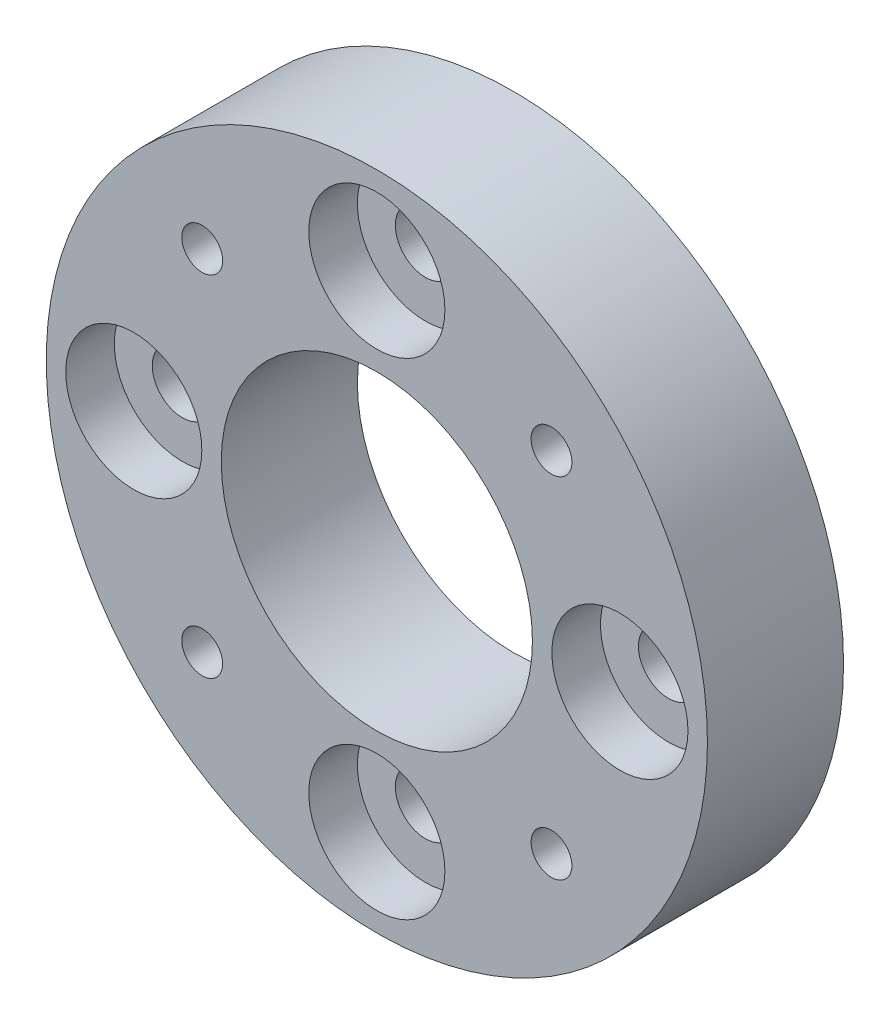
from build123d import *

# Parameters (mm, degrees)
SKETCH1_R           = 17
SKETCH1_R_2         = 1.55
SKETCH1_R_3         = 1.05
SKETCH1_R_4         = 8
BOSS_EXTRUDE1_DEPTH = 7
SKETCH2_R           = 3.5
CUT_EXTRUDE2_DEPTH  = 2.5


with BuildPart() as part:
    # Sketch1 → Boss-Extrude1 (new body)
    with BuildSketch(Plane.XY):
        Circle(SKETCH1_R)
        with Locations((0, 12.5)):
            Circle(SKETCH1_R_2, mode=Mode.SUBTRACT)
        with Locations((12.5, 0)):
            Circle(SKETCH1_R_2, mode=Mode.SUBTRACT)
        with Locations((0, -12.5)):
            Circle(SKETCH1_R_2, mode=Mode.SUBTRACT)
        with Locations((-12.5, 0)):
            Circle(SKETCH1_R_2, mode=Mode.SUBTRACT)
        with Locations((-8.980256121, 8.980256121)):
            Circle(SKETCH1_R_3, mode=Mode.SUBTRACT)
        with Locations((8.980256121, 8.980256121)):
            Circle(SKETCH1_R_3, mode=Mode.SUBTRACT)
        with Locations((8.980256121, -8.980256121)):
            Circle(SKETCH1_R_3, mode=Mode.SUBTRACT)
        with Locations((-8.980256121, -8.980256121)):
            Circle(SKETCH1_R_3, mode=Mode.SUBTRACT)
        Circle(SKETCH1_R_4, mode=Mode.SUBTRACT)
    extrude(amount=BOSS_EXTRUDE1_DEPTH)

    # Sketch2 → Cut-Extrude2 (cut)
    with BuildSketch(Plane.XY.offset(7)):
        with Locations((0, 12.5)):
            Circle(SKETCH2_R)
        with Locations((12.5, 0)):
            Circle(SKETCH2_R)
        with Locations((0, -12.5)):
            Circle(SKETCH2_R)
        with Locations((-12.5, 0)):
            Circle(SKETCH2_R)
    extrude(amount=-CUT_EXTRUDE2_DEPTH, mode=Mode.SUBTRACT)


solid = part.part
